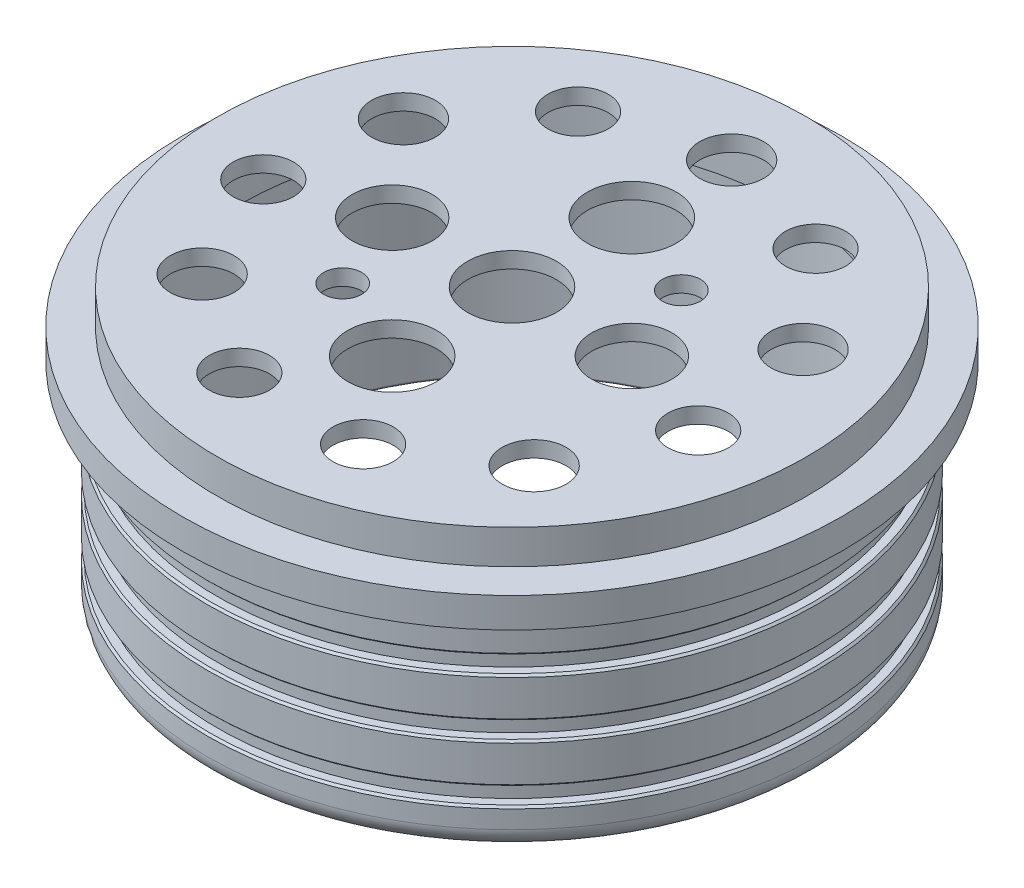
from build123d import *

# Parameters (mm, degrees)
CHAMFER1_SIZE      = 0.5
FILLET3_R          = 5
FILLET4_R          = 0.5
CUT_EXTRUDE1_REACH = 137.513
SKETCH3_R          = 11.125
SKETCH3_R_2        = 10.05
SKETCH3_R_3        = 8
SKETCH3_R_4        = 7.55
SKETCH3_R_5        = 4.7625
SKETCH4_R          = 68
CUT_EXTRUDE2_DEPTH = 12.06


with BuildPart() as part:
    # Sketch2 → Revolve1 (revolve)
    with BuildSketch(Plane.XY, mode=Mode.PRIVATE) as revolve1_sk:
        Polygon((76.25, 52.75), (76.25, 42.75), (73.75, 42.75), (73.75, 38.5), (76.25, 38.5), (76.25, 28.5), (73.75, 28.5), (73.75, 24.25), (76.25, 24.25), (76.25, 14.25), (73.75, 14.25), (73.75, 10), (76.25, 10), (76.25, 0), (69.75, 0), (69.75, 52.75), (0, 52.75), (0, 60.25), (0, 68.810209945), (73.75, 68.810209945), (73.75, 60.25), (82.55, 60.25), (82.55, 52.75), align=None)
    revolve(revolve1_sk.sketch.rotate(Axis((0, 0, 0), (0, 1, 0)), 90), axis=Axis((0, 0, 0), (0, 1, 0)))

    # Chamfer1
    chamfer1_edges = [part.edges().sort_by_distance(p)[0] for p in [
        (0, 42.75, 76.25),
        (0, 38.5, 76.25),
        (0, 28.5, 76.25),
        (0, 24.25, 76.25),
        (0, 14.25, 76.25),
        (0, 10, 76.25),
    ]]
    chamfer(chamfer1_edges, length=CHAMFER1_SIZE)

    # Fillet3
    fillet3_edges = [part.edges().sort_by_distance(p)[0] for p in [
        (0, 0, 76.25),
    ]]
    fillet(fillet3_edges, radius=FILLET3_R)

    # Fillet4
    fillet4_edges = [part.edges().sort_by_distance(p)[0] for p in [
        (0, 0, 69.75),
    ]]
    fillet(fillet4_edges, radius=FILLET4_R)

    # Sketch3 → Cut-Extrude1 (cut, up to next)
    with BuildSketch(Plane(origin=(0, 68.810209945, 0), x_dir=(1, 0, 0), z_dir=(0, 1, 0)), mode=Mode.PRIVATE) as cut_extrude1_sk1:
        with Locations(Location((0, 0, 0), (0, 0, 270))):
            Circle(SKETCH3_R)
    cut_extrude1_tool1 = extrude(cut_extrude1_sk1.sketch, amount=-CUT_EXTRUDE1_REACH, mode=Mode.PRIVATE) & part.part
    # Sketch3 → Cut-Extrude1 (cut, up to next)
    with BuildSketch(Plane(origin=(0, 68.810209945, 0), x_dir=(1, 0, 0), z_dir=(0, 1, 0)), mode=Mode.PRIVATE) as cut_extrude1_sk2:
        with Locations(Location((30, 0, 0), (0, 0, 270))):
            Circle(SKETCH3_R_2)
    cut_extrude1_tool2 = extrude(cut_extrude1_sk2.sketch, amount=-CUT_EXTRUDE1_REACH, mode=Mode.PRIVATE) & part.part
    # Sketch3 → Cut-Extrude1 (cut, up to next)
    with BuildSketch(Plane(origin=(0, 68.810209945, 0), x_dir=(1, 0, 0), z_dir=(0, 1, 0)), mode=Mode.PRIVATE) as cut_extrude1_sk3:
        with Locations(Location((0, -30, 0), (0, 0, 270))):
            Circle(SKETCH3_R)
    cut_extrude1_tool3 = extrude(cut_extrude1_sk3.sketch, amount=-CUT_EXTRUDE1_REACH, mode=Mode.PRIVATE) & part.part
    # Sketch3 → Cut-Extrude1 (cut, up to next)
    with BuildSketch(Plane(origin=(0, 68.810209945, 0), x_dir=(1, 0, 0), z_dir=(0, 1, 0)), mode=Mode.PRIVATE) as cut_extrude1_sk4:
        with Locations(Location((-30, 0, 0), (0, 0, 270))):
            Circle(SKETCH3_R_2)
    cut_extrude1_tool4 = extrude(cut_extrude1_sk4.sketch, amount=-CUT_EXTRUDE1_REACH, mode=Mode.PRIVATE) & part.part
    # Sketch3 → Cut-Extrude1 (cut, up to next)
    with BuildSketch(Plane(origin=(0, 68.810209945, 0), x_dir=(1, 0, 0), z_dir=(0, 1, 0)), mode=Mode.PRIVATE) as cut_extrude1_sk5:
        with Locations(Location((0, 30, 0), (0, 0, 270))):
            Circle(SKETCH3_R)
    cut_extrude1_tool5 = extrude(cut_extrude1_sk5.sketch, amount=-CUT_EXTRUDE1_REACH, mode=Mode.PRIVATE) & part.part
    # Sketch3 → Cut-Extrude1 (cut, up to next)
    with BuildSketch(Plane(origin=(0, 68.810209945, 0), x_dir=(1, 0, 0), z_dir=(0, 1, 0)), mode=Mode.PRIVATE) as cut_extrude1_sk6:
        with Locations(Location((0, 55, 0), (0, 0, 270))):
            Circle(SKETCH3_R_3)
    cut_extrude1_tool6 = extrude(cut_extrude1_sk6.sketch, amount=-CUT_EXTRUDE1_REACH, mode=Mode.PRIVATE) & part.part
    # Sketch3 → Cut-Extrude1 (cut, up to next)
    with BuildSketch(Plane(origin=(0, 68.810209945, 0), x_dir=(1, 0, 0), z_dir=(0, 1, 0)), mode=Mode.PRIVATE) as cut_extrude1_sk7:
        with Locations(Location((29.73524496, 46.268944306, 0), (0, 0, 270))):
            Circle(SKETCH3_R_4)
    cut_extrude1_tool7 = extrude(cut_extrude1_sk7.sketch, amount=-CUT_EXTRUDE1_REACH, mode=Mode.PRIVATE) & part.part
    # Sketch3 → Cut-Extrude1 (cut, up to next)
    with BuildSketch(Plane(origin=(0, 68.810209945, 0), x_dir=(1, 0, 0), z_dir=(0, 1, 0)), mode=Mode.PRIVATE) as cut_extrude1_sk8:
        with Locations(Location((50.029759744, 22.847825715, 0), (0, 0, 270))):
            Circle(SKETCH3_R_3)
    cut_extrude1_tool8 = extrude(cut_extrude1_sk8.sketch, amount=-CUT_EXTRUDE1_REACH, mode=Mode.PRIVATE) & part.part
    # Sketch3 → Cut-Extrude1 (cut, up to next)
    with BuildSketch(Plane(origin=(0, 68.810209945, 0), x_dir=(1, 0, 0), z_dir=(0, 1, 0)), mode=Mode.PRIVATE) as cut_extrude1_sk9:
        with Locations(Location((54.440179303, -7.827316105, 0), (0, 0, 270))):
            Circle(SKETCH3_R_4)
    cut_extrude1_tool9 = extrude(cut_extrude1_sk9.sketch, amount=-CUT_EXTRUDE1_REACH, mode=Mode.PRIVATE) & part.part
    # Sketch3 → Cut-Extrude1 (cut, up to next)
    with BuildSketch(Plane(origin=(0, 68.810209945, 0), x_dir=(1, 0, 0), z_dir=(0, 1, 0)), mode=Mode.PRIVATE) as cut_extrude1_sk10:
        with Locations(Location((41.566226589, -36.017340367, 0), (0, 0, 270))):
            Circle(SKETCH3_R_3)
    cut_extrude1_tool10 = extrude(cut_extrude1_sk10.sketch, amount=-CUT_EXTRUDE1_REACH, mode=Mode.PRIVATE) & part.part
    # Sketch3 → Cut-Extrude1 (cut, up to next)
    with BuildSketch(Plane(origin=(0, 68.810209945, 0), x_dir=(1, 0, 0), z_dir=(0, 1, 0)), mode=Mode.PRIVATE) as cut_extrude1_sk11:
        with Locations(Location((15.495290626, -52.772113549, 0), (0, 0, 270))):
            Circle(SKETCH3_R_4)
    cut_extrude1_tool11 = extrude(cut_extrude1_sk11.sketch, amount=-CUT_EXTRUDE1_REACH, mode=Mode.PRIVATE) & part.part
    # Sketch3 → Cut-Extrude1 (cut, up to next)
    with BuildSketch(Plane(origin=(0, 68.810209945, 0), x_dir=(1, 0, 0), z_dir=(0, 1, 0)), mode=Mode.PRIVATE) as cut_extrude1_sk12:
        with Locations(Location((-15.495290626, -52.772113549, 0), (0, 0, 270))):
            Circle(SKETCH3_R_4)
    cut_extrude1_tool12 = extrude(cut_extrude1_sk12.sketch, amount=-CUT_EXTRUDE1_REACH, mode=Mode.PRIVATE) & part.part
    # Sketch3 → Cut-Extrude1 (cut, up to next)
    with BuildSketch(Plane(origin=(0, 68.810209945, 0), x_dir=(1, 0, 0), z_dir=(0, 1, 0)), mode=Mode.PRIVATE) as cut_extrude1_sk13:
        with Locations(Location((-41.566226589, -36.017340367, 0), (0, 0, 270))):
            Circle(SKETCH3_R_3)
    cut_extrude1_tool13 = extrude(cut_extrude1_sk13.sketch, amount=-CUT_EXTRUDE1_REACH, mode=Mode.PRIVATE) & part.part
    # Sketch3 → Cut-Extrude1 (cut, up to next)
    with BuildSketch(Plane(origin=(0, 68.810209945, 0), x_dir=(1, 0, 0), z_dir=(0, 1, 0)), mode=Mode.PRIVATE) as cut_extrude1_sk14:
        with Locations(Location((-54.440179303, -7.827316105, 0), (0, 0, 270))):
            Circle(SKETCH3_R_4)
    cut_extrude1_tool14 = extrude(cut_extrude1_sk14.sketch, amount=-CUT_EXTRUDE1_REACH, mode=Mode.PRIVATE) & part.part
    # Sketch3 → Cut-Extrude1 (cut, up to next)
    with BuildSketch(Plane(origin=(0, 68.810209945, 0), x_dir=(1, 0, 0), z_dir=(0, 1, 0)), mode=Mode.PRIVATE) as cut_extrude1_sk15:
        with Locations(Location((-50.029759744, 22.847825715, 0), (0, 0, 270))):
            Circle(SKETCH3_R_3)
    cut_extrude1_tool15 = extrude(cut_extrude1_sk15.sketch, amount=-CUT_EXTRUDE1_REACH, mode=Mode.PRIVATE) & part.part
    # Sketch3 → Cut-Extrude1 (cut, up to next)
    with BuildSketch(Plane(origin=(0, 68.810209945, 0), x_dir=(1, 0, 0), z_dir=(0, 1, 0)), mode=Mode.PRIVATE) as cut_extrude1_sk16:
        with Locations(Location((-29.73524496, 46.268944306, 0), (0, 0, 270))):
            Circle(SKETCH3_R_4)
    cut_extrude1_tool16 = extrude(cut_extrude1_sk16.sketch, amount=-CUT_EXTRUDE1_REACH, mode=Mode.PRIVATE) & part.part
    # Sketch3 → Cut-Extrude1 (cut, up to next)
    with BuildSketch(Plane(origin=(0, 68.810209945, 0), x_dir=(1, 0, 0), z_dir=(0, 1, 0)), mode=Mode.PRIVATE) as cut_extrude1_sk17:
        with Locations(Location((21.940611049, 20.459950802, 0), (0, 0, 270))):
            Circle(SKETCH3_R_5)
    cut_extrude1_tool17 = extrude(cut_extrude1_sk17.sketch, amount=-CUT_EXTRUDE1_REACH, mode=Mode.PRIVATE) & part.part
    # Sketch3 → Cut-Extrude1 (cut, up to next)
    with BuildSketch(Plane(origin=(0, 68.810209945, 0), x_dir=(1, 0, 0), z_dir=(0, 1, 0)), mode=Mode.PRIVATE) as cut_extrude1_sk18:
        with Locations(Location((-21.940611049, -20.459950802, 0), (0, 0, 90))):
            Circle(SKETCH3_R_5)
    cut_extrude1_tool18 = extrude(cut_extrude1_sk18.sketch, amount=-CUT_EXTRUDE1_REACH, mode=Mode.PRIVATE) & part.part
    add(cut_extrude1_tool1.solids().sort_by_distance((0, 68.81021, 0))[0], mode=Mode.SUBTRACT)
    add(cut_extrude1_tool2.solids().sort_by_distance((30, 68.81021, 0))[0], mode=Mode.SUBTRACT)
    add(cut_extrude1_tool3.solids().sort_by_distance((0, 68.81021, 30))[0], mode=Mode.SUBTRACT)
    add(cut_extrude1_tool4.solids().sort_by_distance((-30, 68.81021, 0))[0], mode=Mode.SUBTRACT)
    add(cut_extrude1_tool5.solids().sort_by_distance((0, 68.81021, -30))[0], mode=Mode.SUBTRACT)
    add(cut_extrude1_tool6.solids().sort_by_distance((0, 68.81021, -55))[0], mode=Mode.SUBTRACT)
    add(cut_extrude1_tool7.solids().sort_by_distance((29.735245, 68.81021, -46.268944))[0], mode=Mode.SUBTRACT)
    add(cut_extrude1_tool8.solids().sort_by_distance((50.02976, 68.81021, -22.847826))[0], mode=Mode.SUBTRACT)
    add(cut_extrude1_tool9.solids().sort_by_distance((54.440179, 68.81021, 7.827316))[0], mode=Mode.SUBTRACT)
    add(cut_extrude1_tool10.solids().sort_by_distance((41.566227, 68.81021, 36.01734))[0], mode=Mode.SUBTRACT)
    add(cut_extrude1_tool11.solids().sort_by_distance((15.495291, 68.81021, 52.772114))[0], mode=Mode.SUBTRACT)
    add(cut_extrude1_tool12.solids().sort_by_distance((-15.495291, 68.81021, 52.772114))[0], mode=Mode.SUBTRACT)
    add(cut_extrude1_tool13.solids().sort_by_distance((-41.566227, 68.81021, 36.01734))[0], mode=Mode.SUBTRACT)
    add(cut_extrude1_tool14.solids().sort_by_distance((-54.440179, 68.81021, 7.827316))[0], mode=Mode.SUBTRACT)
    add(cut_extrude1_tool15.solids().sort_by_distance((-50.02976, 68.81021, -22.847826))[0], mode=Mode.SUBTRACT)
    add(cut_extrude1_tool16.solids().sort_by_distance((-29.735245, 68.81021, -46.268944))[0], mode=Mode.SUBTRACT)
    add(cut_extrude1_tool17.solids().sort_by_distance((21.940611, 68.81021, -20.459951))[0], mode=Mode.SUBTRACT)
    add(cut_extrude1_tool18.solids().sort_by_distance((-21.940611, 68.81021, 20.459951))[0], mode=Mode.SUBTRACT)

    # Sketch4 → Cut-Extrude2 (cut)
    with BuildSketch(Plane.XZ.offset(-52.75)):
        with Locations(Location((0, 0, 0), (0, 0, 270))):
            Circle(SKETCH4_R)
    extrude(amount=-CUT_EXTRUDE2_DEPTH, mode=Mode.SUBTRACT)


solid = part.part
